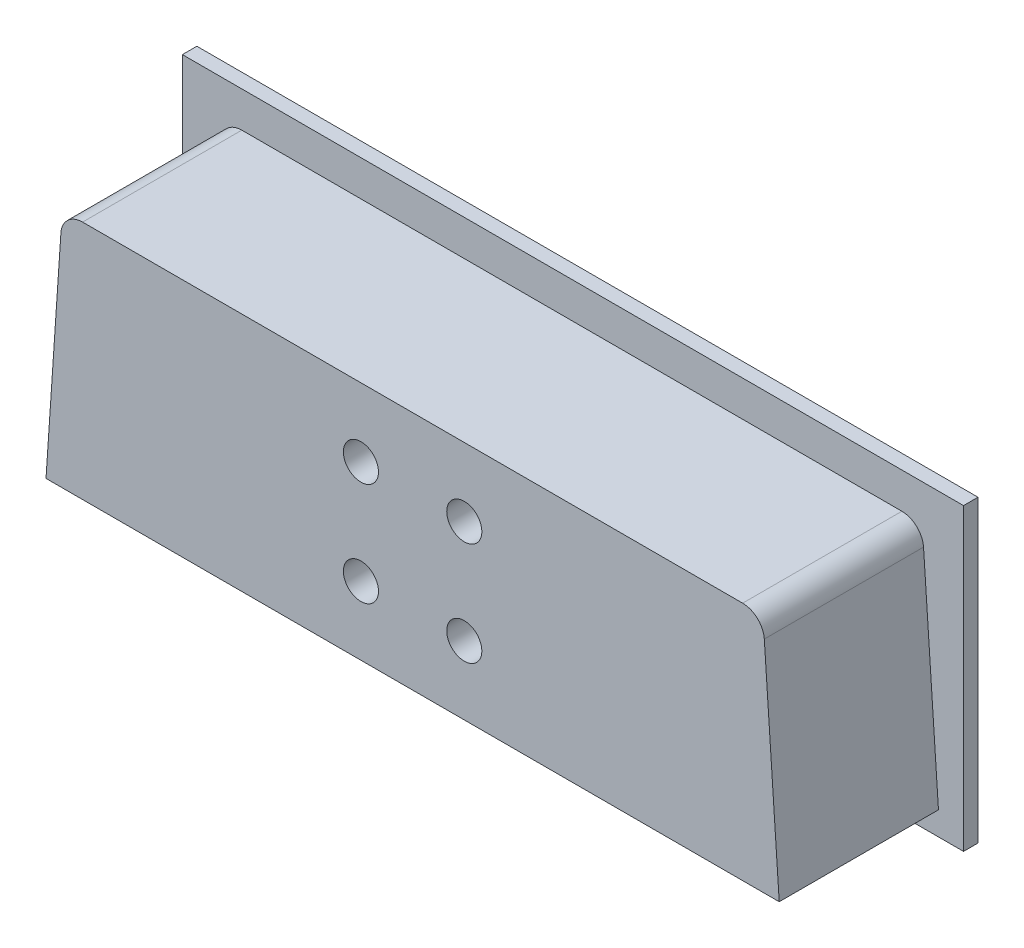
from build123d import *

# Parameters (mm, degrees)
P_IDAT_VYSUNUT_M1_DEPTH  = 22
ZAOBLIT1_R               = 3
SKICA2_W                 = 107.918638888
SKICA2_H                 = 41.380791124
P_IDAT_VYSUNUT_M2_DEPTH  = 2
SKICA3_R                 = 2.425
ODEBRAT_VYSUNUT_M1_DEPTH = 8.5


with BuildPart() as part:
    # Skica1 → Přidat vysunutím1 (new body)
    with BuildSketch(Plane.XY):
        Polygon((0, 0), (101.3, 0), (99.05, 33.2), (2.25, 33.2), align=None)
    extrude(amount=P_IDAT_VYSUNUT_M1_DEPTH)

    # Zaoblit1
    zaoblit1_edges = [part.edges().sort_by_distance(p)[0] for p in [
        (2.25, 33.2, 11),
        (99.05, 33.2, 11),
    ]]
    fillet(zaoblit1_edges, radius=ZAOBLIT1_R)

    # Skica2 → Přidat vysunutím2 (add)
    with BuildSketch(Plane(origin=(0, 0, 0), x_dir=(-1, 0, 0), z_dir=(0, 0, -1))):
        with Locations((-50.804022796, 17.445366235)):
            Rectangle(SKICA2_W, SKICA2_H)
    extrude(amount=P_IDAT_VYSUNUT_M2_DEPTH)

    # Skica3 → Odebrat vysunutím1 (cut)
    with BuildSketch(Plane.XY.offset(22)):
        with Locations((57.79, 9.455)):
            Circle(SKICA3_R)
        with Locations(Location((43.51, 9.455, 0), (0, 0, 180))):
            Circle(SKICA3_R)
        with Locations(Location((57.79, 23.735, 0), (0, 0, 180))):
            Circle(SKICA3_R)
        with Locations((43.51, 23.735)):
            Circle(SKICA3_R)
    extrude(amount=-ODEBRAT_VYSUNUT_M1_DEPTH, mode=Mode.SUBTRACT)


solid = part.part
